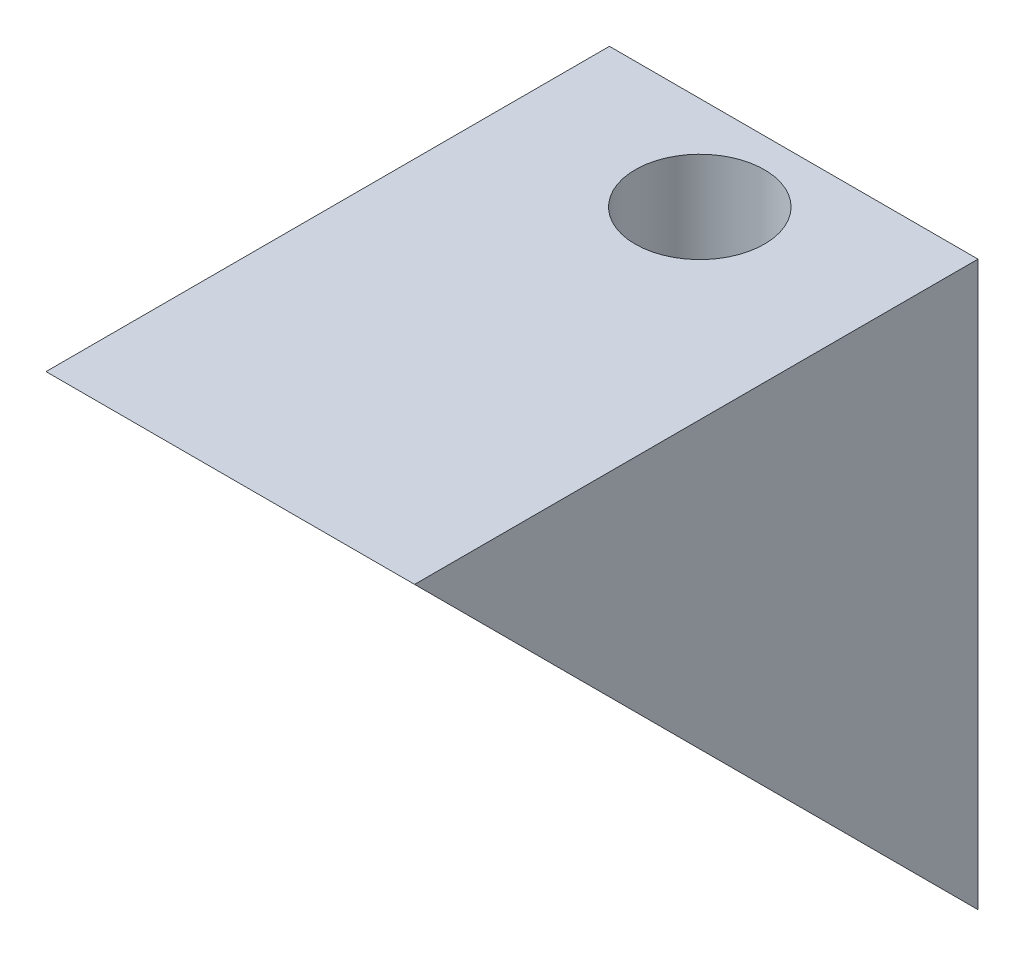
from build123d import *

# Parameters (mm, degrees)
BOSS_EXTRUDE1_DEPTH = 39.25
SKETCH4_R           = 13.75
CUT_EXTRUDE1_DEPTH  = 30
SKETCH7_R           = 9.75
SKETCH6_R           = 10.2
SKETCH5_R           = 3.5
CUT_EXTRUDE2_DEPTH  = 15


with BuildPart() as part:
    # Sketch2 → Boss-Extrude1 (new, symmetric)
    with BuildSketch(Plane(origin=(0, 0, 0), x_dir=(0, 0, -1), z_dir=(1, 0, 0))):
        Polygon((-100, -24.35604681), (20, -144.35604681), (20, -24.35604681), align=None)
    extrude(amount=BOSS_EXTRUDE1_DEPTH, both=True)

    # Sketch4 → Cut-Extrude1 (cut)
    with BuildSketch(Plane(origin=(0, -24.35604681, 0), x_dir=(1, 0, 0), z_dir=(0, 1, 0))):
        with Locations(Location((0, 0, 0), (0, 0, 270))):
            Circle(SKETCH4_R)
    extrude(amount=-CUT_EXTRUDE1_DEPTH, mode=Mode.SUBTRACT)

    # Sketch7 → Cut-Loft1 section 0
    with BuildSketch(Plane(origin=(0, -84.35604681, 0), x_dir=(1, 0, 0), z_dir=(0, 1, 0))):
        Circle(SKETCH7_R)
    # Sketch6 → Cut-Loft1 section 1
    with BuildSketch(Plane(origin=(0, -54.35604681, 0), x_dir=(1, 0, 0), z_dir=(0, 1, 0))):
        Circle(SKETCH6_R)
    loft(mode=Mode.SUBTRACT)

    # Sketch5 → Cut-Extrude2 (cut)
    with BuildSketch(Plane(origin=(0, 0, -20), x_dir=(-1, 0, 0), z_dir=(0, 0, -1))):
        with Locations(Location((0, -59.35604681, 0), (0, 0, 90))):
            Circle(SKETCH5_R)
        with Locations(Location((0, -74.35604681, 0), (0, 0, 90))):
            Circle(SKETCH5_R)
    extrude(amount=-CUT_EXTRUDE2_DEPTH, mode=Mode.SUBTRACT)


solid = part.part
